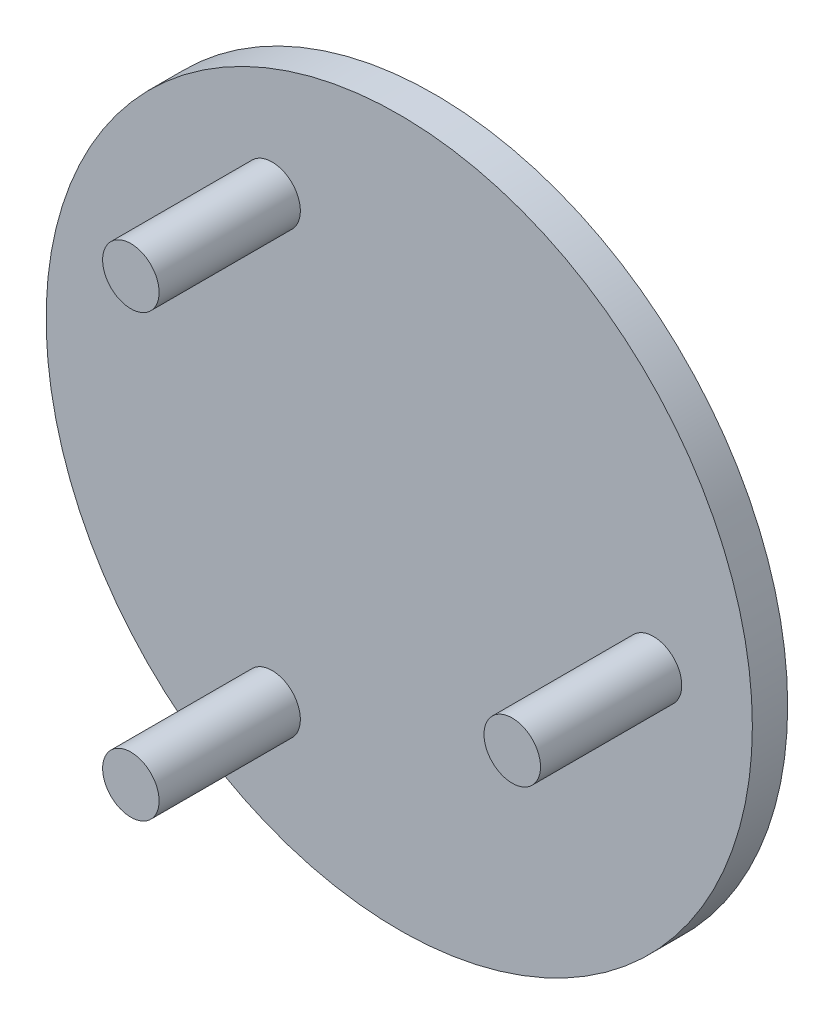
from build123d import *

# Parameters (mm, degrees)
SKETCH1_R           = 50
BOSS_EXTRUDE1_DEPTH = 5
SKETCH2_R           = 4
BOSS_EXTRUDE2_DEPTH = 20


with BuildPart() as part:
    # Sketch1 → Boss-Extrude1 (new body)
    with BuildSketch(Plane.XY):
        Circle(SKETCH1_R)
    extrude(amount=-BOSS_EXTRUDE1_DEPTH)

    # Sketch2 → Boss-Extrude2 (add)
    with BuildSketch(Plane.XY):
        with Locations((36, 0)):
            Circle(SKETCH2_R)
        with Locations((-18, 31.176914536)):
            Circle(SKETCH2_R)
        with Locations((-18, -31.176914536)):
            Circle(SKETCH2_R)
    extrude(amount=BOSS_EXTRUDE2_DEPTH)


solid = part.part
